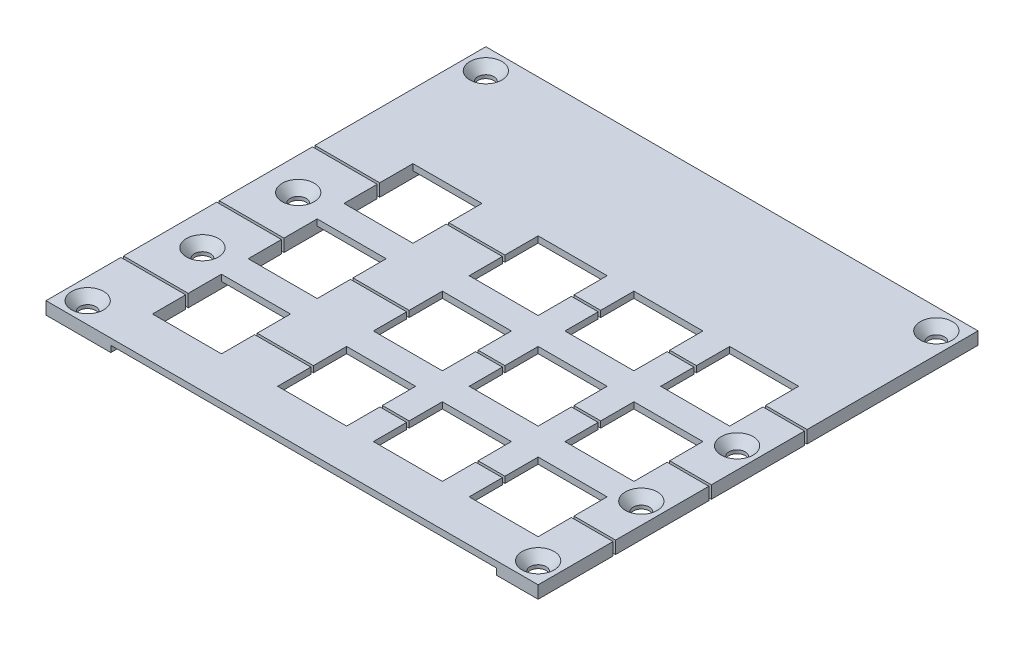
from build123d import *

# Parameters (mm, degrees)
SKETCH1_W                                     = 99.4664
SKETCH1_H                                     = 88.9
SKETCH1_W_2                                   = 13.9446
SKETCH1_H_2                                   = 13.9446
BOSS_EXTRUDE1_DEPTH                           = 1.27
SKETCH6_W                                     = 13.0937
SKETCH6_H                                     = 88.9
SKETCH6_W_2                                   = 8.4201
BOSS_EXTRUDE2_DEPTH                           = 1.27
SKETCH2_W                                     = 99.4664
SKETCH2_H                                     = 0.508
CUT_EXTRUDE_THIN2_DEPTH                       = 67.750620089
CSK_FOR_4_FLAT_HEAD_SOCKET_CAP_SCREW1_A_COUNT = 2
CSK_FOR_4_FLAT_HEAD_SOCKET_CAP_SCREW1_A_PITCH = 91.0463
CSK_FOR_4_FLAT_HEAD_SOCKET_CAP_SCRE_2_COUNT   = 2
CSK_FOR_4_FLAT_HEAD_SOCKET_CAP_SCRE_2_PITCH   = 121.517254115
CSK_FOR_4_FLAT_HEAD_SOCKET_CAP_SCRE_3_COUNT   = 2
CSK_FOR_4_FLAT_HEAD_SOCKET_CAP_SCRE_3_PITCH   = 80.4799
CSK_FOR_4_FLAT_HEAD_SOCKET_CAP_SCRE_4_COUNT   = 2
CSK_FOR_4_FLAT_HEAD_SOCKET_CAP_SCRE_4_PITCH   = 40.333101106
CSK_FOR_4_FLAT_HEAD_SOCKET_CAP_SCRE_5_COUNT   = 2
CSK_FOR_4_FLAT_HEAD_SOCKET_CAP_SCRE_5_PITCH   = 59.665927633
CSK_FOR_4_FLAT_HEAD_SOCKET_CAP_SCRE_6_COUNT   = 2
CSK_FOR_4_FLAT_HEAD_SOCKET_CAP_SCRE_6_PITCH   = 108.830101671
CSK_FOR_4_FLAT_HEAD_SOCKET_CAP_SCRE_7_COUNT   = 2
CSK_FOR_4_FLAT_HEAD_SOCKET_CAP_SCRE_7_PITCH   = 99.552635095


with BuildPart() as part:
    # Sketch1 → Boss-Extrude1 (new body)
    with BuildSketch(Plane(origin=(0, 0, 0), x_dir=(1, 0, 0), z_dir=(0, 1, 0))):
        Rectangle(SKETCH1_W, SKETCH1_H)
        with Locations((-4.3688, 9.652)):
            Rectangle(SKETCH1_W_2, SKETCH1_H_2, mode=Mode.SUBTRACT)
        with Locations((14.986, 9.652)):
            Rectangle(SKETCH1_W_2, SKETCH1_H_2, mode=Mode.SUBTRACT)
        with Locations((34.3408, 9.652)):
            Rectangle(SKETCH1_W_2, SKETCH1_H_2, mode=Mode.SUBTRACT)
        with Locations((-4.3688, -9.7028)):
            Rectangle(SKETCH1_W_2, SKETCH1_H_2, mode=Mode.SUBTRACT)
        with Locations((14.986, -9.7028)):
            Rectangle(SKETCH1_W_2, SKETCH1_H_2, mode=Mode.SUBTRACT)
        with Locations((34.3408, -9.7028)):
            Rectangle(SKETCH1_W_2, SKETCH1_H_2, mode=Mode.SUBTRACT)
        with Locations((-4.3688, -29.0576)):
            Rectangle(SKETCH1_W_2, SKETCH1_H_2, mode=Mode.SUBTRACT)
        with Locations((14.986, -29.0576)):
            Rectangle(SKETCH1_W_2, SKETCH1_H_2, mode=Mode.SUBTRACT)
        with Locations((34.3408, -29.0576)):
            Rectangle(SKETCH1_W_2, SKETCH1_H_2, mode=Mode.SUBTRACT)
        with Locations((-29.6672, 9.652)):
            Rectangle(SKETCH1_W_2, SKETCH1_H_2, mode=Mode.SUBTRACT)
        with Locations((-29.6672, -9.7028)):
            Rectangle(SKETCH1_W_2, SKETCH1_H_2, mode=Mode.SUBTRACT)
        with Locations((-29.6672, -29.0576)):
            Rectangle(SKETCH1_W_2, SKETCH1_H_2, mode=Mode.SUBTRACT)
    extrude(amount=BOSS_EXTRUDE1_DEPTH)

    # Sketch6 → Boss-Extrude2 (add)
    with BuildSketch(Plane.XZ):
        with Locations((-43.18635, 0)):
            Rectangle(SKETCH6_W, SKETCH6_H)
        with Locations((45.52315, 0)):
            Rectangle(SKETCH6_W_2, SKETCH6_H)
    extrude(amount=BOSS_EXTRUDE2_DEPTH)

    # Sketch2 → Cut-Extrude-Thin2 (cut, through all)
    with BuildSketch(Plane(origin=(0, 1.27, 0), x_dir=(1, 0, 0), z_dir=(0, 1, 0))):
        with Locations((0, 9.652)):
            Rectangle(SKETCH2_W, SKETCH2_H)
        with Locations((0, -9.7028)):
            Rectangle(SKETCH2_W, SKETCH2_H)
        with Locations((0, -29.0576)):
            Rectangle(SKETCH2_W, SKETCH2_H)
    extrude(amount=-CUT_EXTRUDE_THIN2_DEPTH, mode=Mode.SUBTRACT)


with BuildPart() as cut_extrude_thin2_piece_1:
    # of the separate pieces the step leaves, piece 1, a body of its own (cut_extrude_thin2_pieces)
    add(part.part.solids().sort_by_distance((-49.7332, 1.27, -44.45))[0])

    # Sketch7 → CSK for #4 Flat Head Socket Cap Screw1 (revolve, cut)
    with BuildSketch(Plane(origin=(-45.52315, 1.27, -40.23995), x_dir=(0, 0, 1), z_dir=(1, 0, 0))):
        Polygon((0, 0), (0, 2.54), (1.63195, 2.54), (1.63195, 1.848124365), (3.2385, 0), align=None)
    csk_for_4_flat_head_socket_cap_screw1 = revolve(axis=Axis((-45.52315, 7.62, -40.23995), (0, -1, 0)), mode=Mode.SUBTRACT)

    # CSK for #4 Flat Head Socket Cap Screw1 a: CSK for #4 Flat Head Socket Cap Screw1 ×2
    with Locations(*[(i * CSK_FOR_4_FLAT_HEAD_SOCKET_CAP_SCREW1_A_PITCH, 0, 0) for i in range(1, CSK_FOR_4_FLAT_HEAD_SOCKET_CAP_SCREW1_A_COUNT)]):
        add(csk_for_4_flat_head_socket_cap_screw1, mode=Mode.SUBTRACT)


with BuildPart() as cut_extrude_thin2_piece_2:
    # of the separate pieces the step leaves, piece 2, a body of its own (cut_extrude_thin2_pieces)
    add(part.part.solids().sort_by_distance((-49.7332, 1.27, -9.398))[0])

    # CSK for _4 Flat Head Socket Cap Scre 4: CSK for #4 Flat Head Socket Cap Screw1 ×2
    with Locations(*[Vector(0.057937523669032404, 0, 0.9983202108297219) * (i * CSK_FOR_4_FLAT_HEAD_SOCKET_CAP_SCRE_4_PITCH) for i in range(1, CSK_FOR_4_FLAT_HEAD_SOCKET_CAP_SCRE_4_COUNT)]):
        add(csk_for_4_flat_head_socket_cap_screw1, mode=Mode.SUBTRACT)

    # CSK for _4 Flat Head Socket Cap Scre 7: CSK for #4 Flat Head Socket Cap Screw1 ×2
    with Locations(*[Vector(0.9145543954042744, 0, 0.4044629251819284) * (i * CSK_FOR_4_FLAT_HEAD_SOCKET_CAP_SCRE_7_PITCH) for i in range(1, CSK_FOR_4_FLAT_HEAD_SOCKET_CAP_SCRE_7_COUNT)]):
        add(csk_for_4_flat_head_socket_cap_screw1, mode=Mode.SUBTRACT)


with BuildPart() as cut_extrude_thin2_piece_3:
    # of the separate pieces the step leaves, piece 3, a body of its own (cut_extrude_thin2_pieces)
    add(part.part.solids().sort_by_distance((-49.7332, 1.27, 9.9568))[0])

    # CSK for _4 Flat Head Socket Cap Scre 5: CSK for #4 Flat Head Socket Cap Screw1 ×2
    with Locations(*[Vector(0.03916473090618548, 0, 0.9992327676037481) * (i * CSK_FOR_4_FLAT_HEAD_SOCKET_CAP_SCRE_5_PITCH) for i in range(1, CSK_FOR_4_FLAT_HEAD_SOCKET_CAP_SCRE_5_COUNT)]):
        add(csk_for_4_flat_head_socket_cap_screw1, mode=Mode.SUBTRACT)

    # CSK for _4 Flat Head Socket Cap Scre 6: CSK for #4 Flat Head Socket Cap Screw1 ×2
    with Locations(*[Vector(0.8365911508129258, 0, 0.5478277524747213) * (i * CSK_FOR_4_FLAT_HEAD_SOCKET_CAP_SCRE_6_PITCH) for i in range(1, CSK_FOR_4_FLAT_HEAD_SOCKET_CAP_SCRE_6_COUNT)]):
        add(csk_for_4_flat_head_socket_cap_screw1, mode=Mode.SUBTRACT)


with BuildPart() as cut_extrude_thin2_piece_4:
    # of the separate pieces the step leaves, piece 4, a body of its own (cut_extrude_thin2_pieces)
    add(part.part.solids().sort_by_distance((-49.7332, 1.27, 44.45))[0])

    # CSK for _4 Flat Head Socket Cap Scre 2: CSK for #4 Flat Head Socket Cap Screw1 ×2
    with Locations(*[Vector(0.7492458635847796, 0, 0.6622919566936457) * (i * CSK_FOR_4_FLAT_HEAD_SOCKET_CAP_SCRE_2_PITCH) for i in range(1, CSK_FOR_4_FLAT_HEAD_SOCKET_CAP_SCRE_2_COUNT)]):
        add(csk_for_4_flat_head_socket_cap_screw1, mode=Mode.SUBTRACT)

    # CSK for _4 Flat Head Socket Cap Scre 3: CSK for #4 Flat Head Socket Cap Screw1 ×2
    with Locations(*[(0, 0, i * CSK_FOR_4_FLAT_HEAD_SOCKET_CAP_SCRE_3_PITCH) for i in range(1, CSK_FOR_4_FLAT_HEAD_SOCKET_CAP_SCRE_3_COUNT)]):
        add(csk_for_4_flat_head_socket_cap_screw1, mode=Mode.SUBTRACT)


solid = Compound([cut_extrude_thin2_piece_1.part, cut_extrude_thin2_piece_2.part, cut_extrude_thin2_piece_3.part, cut_extrude_thin2_piece_4.part])
